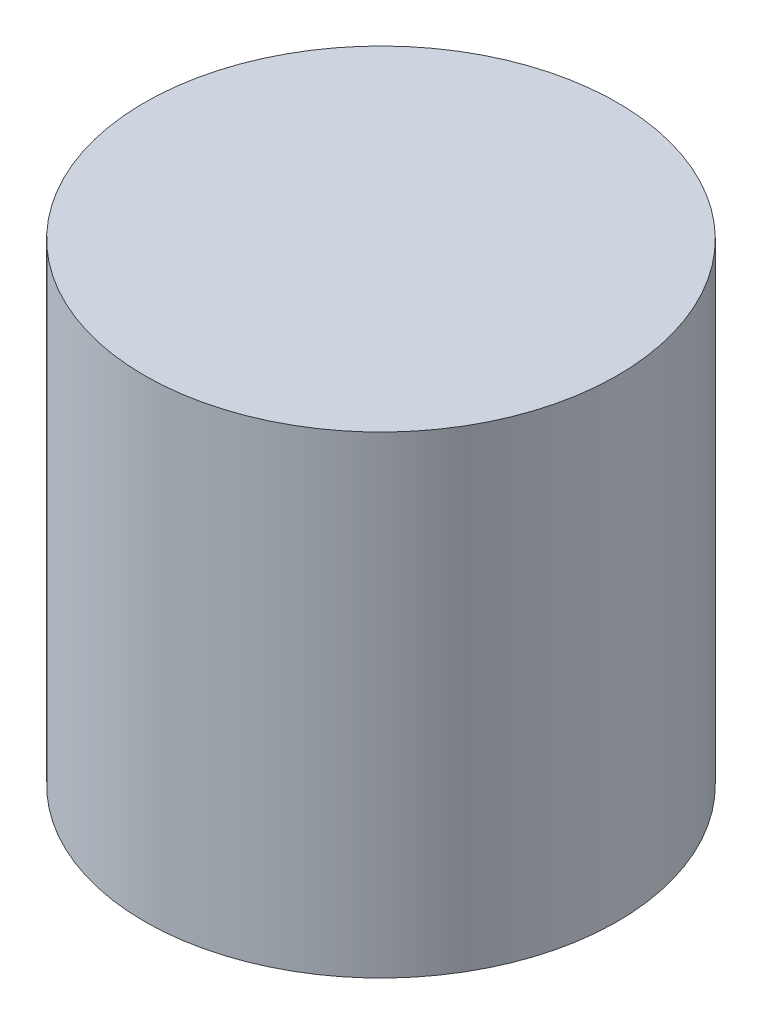
from build123d import *

# Parameters (mm, degrees)
SKETCH1_R           = 31.5
BOSS_EXTRUDE1_DEPTH = 63


with BuildPart() as part:
    # Sketch1 → Boss-Extrude1 (new body)
    with BuildSketch(Plane(origin=(0, 0, 0), x_dir=(1, 0, 0), z_dir=(0, 1, 0))):
        with Locations(Location((0, 0, 0), (0, 0, 270))):
            Circle(SKETCH1_R)
    extrude(amount=BOSS_EXTRUDE1_DEPTH)


solid = part.part
